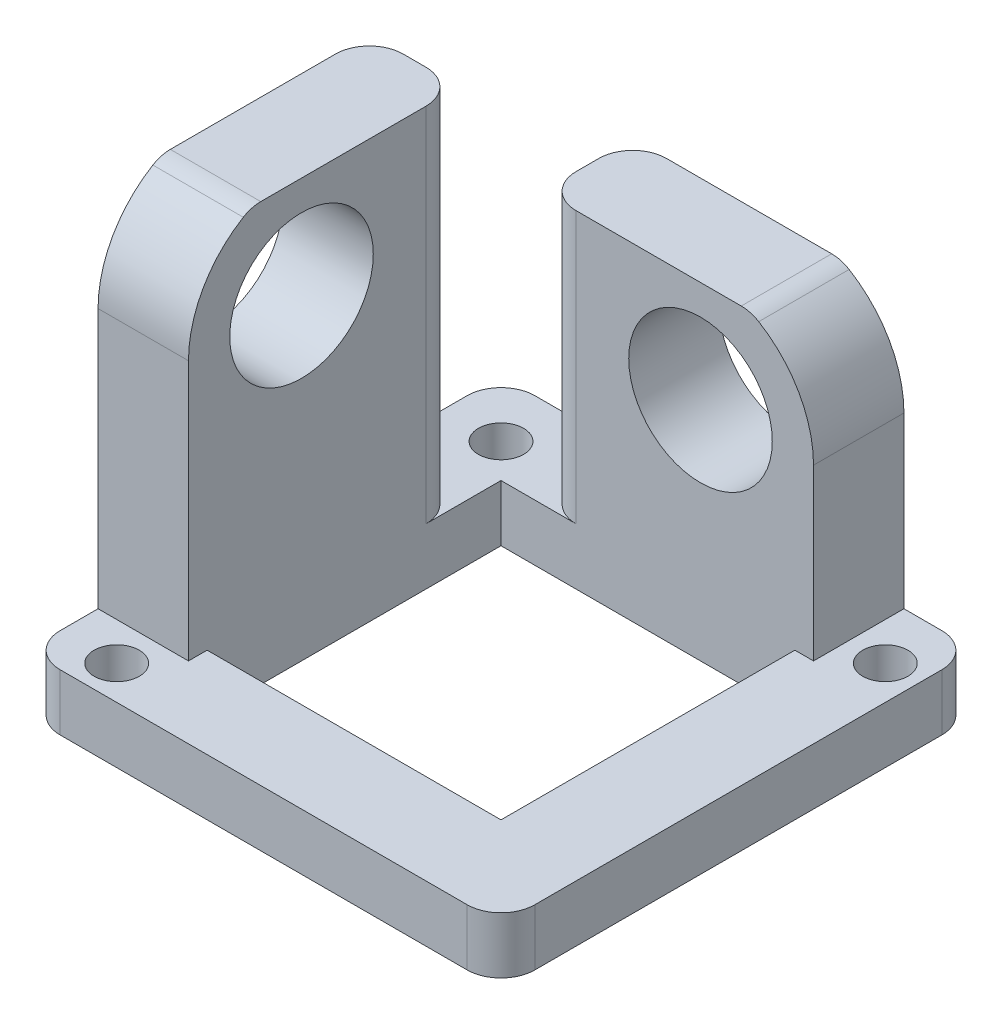
from build123d import *

# Parameters (mm, degrees)
SKETCH_1_R          = 2
SKETCH_1_W          = 26
SKETCH_1_H          = 26
EXTRUDE_1_DEPTH     = 5
EXTRUDE_2_DEPTH     = 24
EXTRUDE_3_DEPTH     = 32
CUT_EXTRUDE_1_REACH = 71.979
SKETCH_3_R          = 6.35
CUT_EXTRUDE_2_REACH = 67.49
SKETCH_4_R          = 6.35
FILLET_2_R          = 3


with BuildPart() as part:
    # 草图1 → 凸台-拉伸1 (new body)
    with BuildSketch(Plane(origin=(0, 0, 0), x_dir=(1, 0, 0), z_dir=(0, 1, 0))):
        with BuildLine():
            Line((3, 0), (39, 0))
            ThreePointArc((39, 0), (41.121320344, 0.878679656), (42, 3))
            Line((42, 3), (42, 39))
            ThreePointArc((42, 39), (41.121320344, 41.121320344), (39, 42))
            Line((39, 42), (3, 42))
            ThreePointArc((3, 42), (0.878679656, 41.121320344), (0, 39))
            Line((0, 39), (0, 3))
            ThreePointArc((0, 3), (0.878679656, 0.878679656), (3, 0))
        make_face()
        with Locations((5, 37)):
            Circle(SKETCH_1_R, mode=Mode.SUBTRACT)
        with Locations((39, 37)):
            Circle(SKETCH_1_R, mode=Mode.SUBTRACT)
        with Locations((5, 3)):
            Circle(SKETCH_1_R, mode=Mode.SUBTRACT)
        with Locations((21, 21)):
            Rectangle(SKETCH_1_W, SKETCH_1_H, mode=Mode.SUBTRACT)
    extrude(amount=EXTRUDE_1_DEPTH)

    # 草图2 → 凸台-拉伸2 (add)
    with BuildSketch(Plane(origin=(0, 5, 0), x_dir=(1, 0, 0), z_dir=(0, 1, 0))):
        Polygon((35.65, 34), (35.65, 42), (11.65, 42), (11.65, 34), (34, 34), align=None)
    extrude(amount=EXTRUDE_2_DEPTH)

    # 草图2<3> → 凸台-拉伸3 (add)
    with BuildSketch(Plane(origin=(0, 5, 0), x_dir=(1, 0, 0), z_dir=(0, 1, 0))):
        Polygon((8, 30.35), (0, 30.35), (0, 6.35), (8, 6.35), (8, 8), align=None)
    extrude(amount=EXTRUDE_3_DEPTH)

    # 草图3 → 切除-拉伸1 (cut, up to next)
    with BuildSketch(Plane(origin=(0, 0, -42), x_dir=(-1, 0, 0), z_dir=(0, 0, -1)), mode=Mode.PRIVATE) as cut_extrude_1_sk1:
        with BuildLine():
            Line((-30.008898944, 29), (-35.65, 29))
            Line((-35.65, 29), (-35.65, 20))
            ThreePointArc((-35.65, 20), (-34.123163206, 25.310885546), (-30.008898944, 29))
        make_face()
    cut_extrude_1_tool1 = extrude(cut_extrude_1_sk1.sketch, amount=-CUT_EXTRUDE_1_REACH, mode=Mode.PRIVATE) & part.part
    # 草图3 → 切除-拉伸1 (cut, up to next)
    with BuildSketch(Plane(origin=(0, 0, -42), x_dir=(-1, 0, 0), z_dir=(0, 0, -1)), mode=Mode.PRIVATE) as cut_extrude_1_sk2:
        with Locations((-25.65, 20)):
            Circle(SKETCH_3_R)
    cut_extrude_1_tool2 = extrude(cut_extrude_1_sk2.sketch, amount=-CUT_EXTRUDE_1_REACH, mode=Mode.PRIVATE) & part.part
    add(cut_extrude_1_tool1.solids().sort_by_distance((34.089564, 26.895646, -42))[0], mode=Mode.SUBTRACT)
    add(cut_extrude_1_tool2.solids().sort_by_distance((25.65, 20, -42))[0], mode=Mode.SUBTRACT)

    # 草图4 → 切除-拉伸2 (cut, up to next)
    with BuildSketch(Plane(origin=(8, 0, 0), x_dir=(0, 0, -1), z_dir=(1, 0, 0)), mode=Mode.PRIVATE) as cut_extrude_2_sk1:
        with BuildLine():
            Line((11.991101056, 37), (6.35, 37))
            Line((6.35, 37), (6.35, 28))
            ThreePointArc((6.35, 28), (7.876836794, 33.310885546), (11.991101056, 37))
        make_face()
    cut_extrude_2_tool1 = extrude(cut_extrude_2_sk1.sketch, amount=-CUT_EXTRUDE_2_REACH, mode=Mode.PRIVATE) & part.part
    # 草图4 → 切除-拉伸2 (cut, up to next)
    with BuildSketch(Plane(origin=(8, 0, 0), x_dir=(0, 0, -1), z_dir=(1, 0, 0)), mode=Mode.PRIVATE) as cut_extrude_2_sk2:
        with Locations((16.35, 28)):
            Circle(SKETCH_4_R)
    cut_extrude_2_tool2 = extrude(cut_extrude_2_sk2.sketch, amount=-CUT_EXTRUDE_2_REACH, mode=Mode.PRIVATE) & part.part
    add(cut_extrude_2_tool1.solids().sort_by_distance((8, 34.895646, -7.910436))[0], mode=Mode.SUBTRACT)
    add(cut_extrude_2_tool2.solids().sort_by_distance((8, 28, -16.35))[0], mode=Mode.SUBTRACT)

    # 圆角2
    fillet_2_edges = [part.edges().sort_by_distance(p)[0] for p in [
        (30.008898944, 29, -38),
        (11.65, 17, -42),
        (11.65, 17, -34),
        (4, 37, -11.991101056),
        (0, 21, -30.35),
        (8, 21, -30.35),
    ]]
    fillet(fillet_2_edges, radius=FILLET_2_R)


solid = part.part
